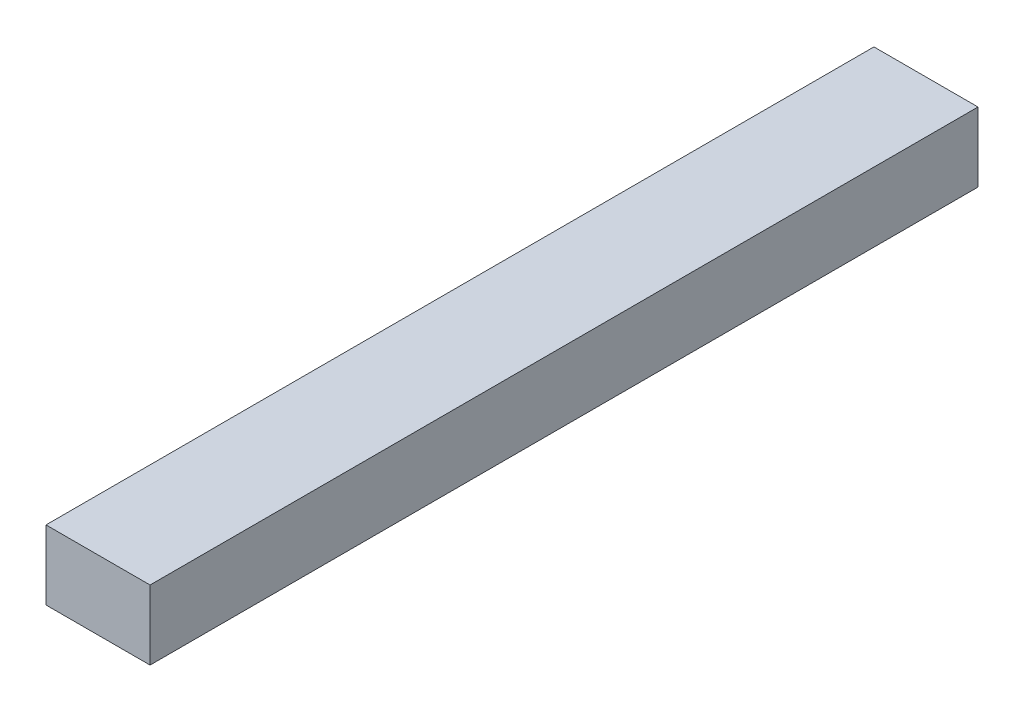
from build123d import *

# Parameters (mm, degrees)
SKETCH1_W           = 45
SKETCH1_H           = 30
BOSS_EXTRUDE1_DEPTH = 358


with BuildPart() as part:
    # Sketch1 → Boss-Extrude1 (new body)
    with BuildSketch(Plane.XY):
        with Locations((-24.669014382, 23.248133662)):
            Rectangle(SKETCH1_W, SKETCH1_H)
    extrude(amount=BOSS_EXTRUDE1_DEPTH)


solid = part.part
